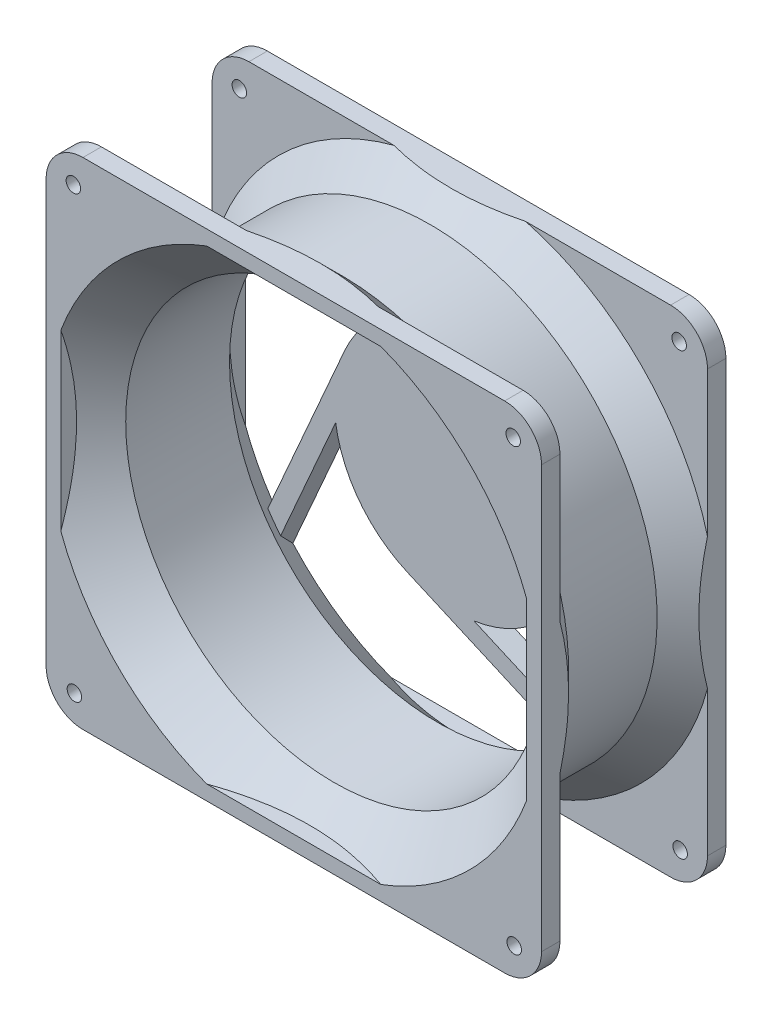
from build123d import *

# Parameters (mm, degrees)
CUT_EXTRUDE1_DEPTH      = 69.31434842
CUT_EXTRUDE1_DEPTH_BACK = 69.31434842
SKETCH3_OUTSIDE_W       = 124.306
SKETCH3_OUTSIDE_H       = 124.306
SKETCH3_OUTSIDE_W_2     = 67.161002078
SKETCH3_OUTSIDE_H_2     = 67.161002078
BOSS_EXTRUDE1_REACH     = 55.668
SKETCH4_W               = 35.612015526
SKETCH4_H               = 2
CIRPATTERN1_COUNT       = 4
MIRROR1_COPY_1_REACH    = 55.668
MIRROR1_COPY_1_SKETCH_W = 35.612015526
MIRROR1_COPY_1_SKETCH_H = 2
MIRROR1_COPY_2_REACH    = 55.668
MIRROR1_COPY_2_SKETCH_W = 35.612015526
MIRROR1_COPY_2_SKETCH_H = 2
MIRROR1_COPY_3_REACH    = 55.668
MIRROR1_COPY_3_SKETCH_W = 35.612015526
MIRROR1_COPY_3_SKETCH_H = 2
FILLET1_R               = 5
BOSS_EXTRUDE2_DEPTH     = 3
SKETCH8_R               = 9.506408827
CUT_EXTRUDE3_DEPTH      = 0.01
CUT_EXTRUDE4_DEPTH      = 0.01
SCALE1_SCALE            = 1.79
CUT_EXTRUDE5_REACH      = 98.066
SKETCH10_R              = 1.757559929


with BuildPart() as part:
    # Sketch2 → Revolve1 (revolve)
    with BuildSketch(Plane(origin=(0, 0, 0), x_dir=(0, 0, -1), z_dir=(1, 0, 0)), mode=Mode.PRIVATE) as revolve1_sk:
        Polygon((-6, 30.75), (6, 30.75), (10, 34.75), (10, 47.49), (12.5, 47.49), (12.5, 33.714466094), (7.035533906, 28.25), (-7.035533906, 28.25), (-12.5, 33.714466094), (-12.5, 47.49), (-10, 47.49), (-10, 34.75), align=None)
    revolve(revolve1_sk.sketch.rotate(Axis((0, 0, -4.682926829), (0, 0, 1)), 90), axis=Axis((0, 0, -4.682926829), (0, 0, 1)))

    # Sketch3 outside → Cut-Extrude1 (cut, two sides: drawn at the far end of the back side and taken through both)
    with BuildSketch(Plane.XY.offset(-CUT_EXTRUDE1_DEPTH_BACK)):
        Rectangle(SKETCH3_OUTSIDE_W, SKETCH3_OUTSIDE_H)
        Rectangle(SKETCH3_OUTSIDE_W_2, SKETCH3_OUTSIDE_H_2, mode=Mode.SUBTRACT)
    extrude(amount=CUT_EXTRUDE1_DEPTH + CUT_EXTRUDE1_DEPTH_BACK, mode=Mode.SUBTRACT)

    # Sketch4 → Boss-Extrude1 (add, up to next)
    with BuildSketch(Plane.XY.offset(12.5), mode=Mode.PRIVATE) as boss_extrude1_sk1:
        with Locations((-0.485506724, 32.580501039)):
            Rectangle(SKETCH4_W, SKETCH4_H)
    boss_extrude1_tool1 = extrude(boss_extrude1_sk1.sketch, amount=-BOSS_EXTRUDE1_REACH, mode=Mode.PRIVATE) - part.part
    boss_extrude1 = boss_extrude1_tool1.solids().sort_by_distance((-0.485507, 32.580501, 12.5))[0]
    add(boss_extrude1)

    # CirPattern1: Boss-Extrude1 ×4 about axis
    cirpattern1_axis = Axis((0, 0, 0), (0, 0, 1))
    for i in range(1, CIRPATTERN1_COUNT):
        add(boss_extrude1.rotate(cirpattern1_axis, i * 360 / CIRPATTERN1_COUNT))

    # Mirror1: Boss-Extrude1 across plane
    add(boss_extrude1.mirror(Plane.XY))

    # Mirror1 copy 1 sketch → Mirror1 copy 1 (add, up to next)
    with BuildSketch(Plane.YX.offset(12.5), mode=Mode.PRIVATE) as mirror1_copy_1_sk1:
        with Locations((-0.485506724, -32.580501039)):
            Rectangle(MIRROR1_COPY_1_SKETCH_W, MIRROR1_COPY_1_SKETCH_H)
    mirror1_copy_1_tool1 = extrude(mirror1_copy_1_sk1.sketch, amount=-MIRROR1_COPY_1_REACH, mode=Mode.PRIVATE) - part.part
    add(mirror1_copy_1_tool1.solids().sort_by_distance((-32.580501, -0.485507, -12.5))[0])

    # Mirror1 copy 2 sketch → Mirror1 copy 2 (add, up to next)
    with BuildSketch(Plane(origin=(0, 0, -12.5), x_dir=(-1, 0, 0), z_dir=(0, 0, -1)), mode=Mode.PRIVATE) as mirror1_copy_2_sk1:
        with Locations((-0.485506724, -32.580501039)):
            Rectangle(MIRROR1_COPY_2_SKETCH_W, MIRROR1_COPY_2_SKETCH_H)
    mirror1_copy_2_tool1 = extrude(mirror1_copy_2_sk1.sketch, amount=-MIRROR1_COPY_2_REACH, mode=Mode.PRIVATE) - part.part
    add(mirror1_copy_2_tool1.solids().sort_by_distance((0.485507, -32.580501, -12.5))[0])

    # Mirror1 copy 3 sketch → Mirror1 copy 3 (add, up to next)
    with BuildSketch(Plane(origin=(0, 0, -12.5), x_dir=(0, -1, 0), z_dir=(0, 0, -1)), mode=Mode.PRIVATE) as mirror1_copy_3_sk1:
        with Locations((-0.485506724, -32.580501039)):
            Rectangle(MIRROR1_COPY_3_SKETCH_W, MIRROR1_COPY_3_SKETCH_H)
    mirror1_copy_3_tool1 = extrude(mirror1_copy_3_sk1.sketch, amount=-MIRROR1_COPY_3_REACH, mode=Mode.PRIVATE) - part.part
    add(mirror1_copy_3_tool1.solids().sort_by_distance((32.580501, 0.485507, -12.5))[0])

    # Fillet1
    fillet1_edges = [part.edges().sort_by_distance(p)[0] for p in [
        (-33.580501039, 33.580501039, -11.25),
        (33.580501039, 33.580501039, -11.25),
        (33.580501039, -33.580501039, -11.25),
        (-33.580501039, -33.580501039, -11.25),
        (-33.580501039, 33.580501039, 11.25),
        (33.580501039, 33.580501039, 11.25),
        (33.580501039, -33.580501039, 11.25),
        (-33.580501039, -33.580501039, 11.25),
    ]]
    fillet(fillet1_edges, radius=FILLET1_R)

    # Sketch5 → Boss-Extrude2 (add)
    with BuildSketch(Plane(origin=(0, 0, -12.5), x_dir=(-1, 0, 0), z_dir=(0, 0, -1))):
        with BuildLine():
            Line((26.925347553, -20.290167154), (15.108670537, 6.631596687))
            ThreePointArc((15.108670537, 6.631596687), (10.016146833, 13.112086127), (2.424441224, 16.320909434))
            Line((2.424441224, 16.320909434), (22.48161384, 25.124535083))
            ThreePointArc((22.48161384, 25.124535083), (21.404836924, 26.047997625), (20.290167154, 26.925347553))
            Line((20.290167154, 26.925347553), (-6.631596687, 15.108670537))
            ThreePointArc((-6.631596687, 15.108670537), (-13.112086127, 10.016146833), (-16.320909434, 2.424441224))
            Line((-16.320909434, 2.424441224), (-25.124535083, 22.48161384))
            ThreePointArc((-25.124535083, 22.48161384), (-26.047997625, 21.404836924), (-26.925347553, 20.290167154))
            Line((-26.925347553, 20.290167154), (-15.108670537, -6.631596687))
            ThreePointArc((-15.108670537, -6.631596687), (-10.016146833, -13.112086127), (-2.424441224, -16.320909434))
            Line((-2.424441224, -16.320909434), (-22.48161384, -25.124535083))
            ThreePointArc((-22.48161384, -25.124535083), (-21.404836924, -26.047997625), (-20.290167154, -26.925347553))
            Line((-20.290167154, -26.925347553), (6.631596687, -15.108670537))
            ThreePointArc((6.631596687, -15.108670537), (13.112086127, -10.016146833), (16.320909434, -2.424441224))
            Line((16.320909434, -2.424441224), (25.124535083, -22.48161384))
            ThreePointArc((25.124535083, -22.48161384), (26.047997625, -21.404836924), (26.925347553, -20.290167154))
        make_face()
    extrude(amount=-BOSS_EXTRUDE2_DEPTH)

    # Sketch8 → Cut-Extrude3 (cut)
    with BuildSketch(Plane(origin=(0, 0, -12.5), x_dir=(-1, 0, 0), z_dir=(0, 0, -1))):
        Circle(SKETCH8_R)
    extrude(amount=-CUT_EXTRUDE3_DEPTH, mode=Mode.SUBTRACT)

    # Sketch9 → Cut-Extrude4 (cut)
    with BuildSketch(Plane(origin=(0, 0, -12.49), x_dir=(-1, 0, 0), z_dir=(0, 0, -1))):
        with BuildLine():
            Line((0.675180288, 4.913461538), (0.852564103, 4.617588141))
            add(Edge.make_bspline(
                [(0.852564103, 4.617588141), (0.806499718, 4.590069904), (0.718242134, 4.537346023), (0.598984093, 4.449394664), (0.497621937, 4.358261753), (0.414745329, 4.263272419), (0.349496442, 4.165006471), (0.303294211, 4.062822417), (0.274478235, 3.957064607), (0.270978149, 3.885090785), (0.269230769, 3.849158654)],
                knots=[0, 0, 0, 0, 1.272034388, 2.437168799, 3.508375237, 4.49857839, 5.41946034, 6.295179144, 7.148887113, 8, 8, 8, 8], degree=3))
            add(Edge.make_bspline(
                [(0.269230769, 3.849158654), (0.270085441, 3.81847179), (0.271779829, 3.757635011), (0.288060647, 3.668072814), (0.313072716, 3.581090837), (0.348893869, 3.498482855), (0.392231555, 3.421384873), (0.444580544, 3.353786497), (0.503176771, 3.295310861), (0.568595717, 3.247609116), (0.63870863, 3.210577942), (0.711319991, 3.18378116), (0.786110405, 3.16672662), (0.836816049, 3.164555919), (0.862379808, 3.163461538)],
                knots=[0, 0, 0, 0, 1.095270387, 2.171376115, 3.241375676, 4.322296363, 5.380636668, 6.392615365, 7.366724986, 8.328592944, 9.273498763, 10.190095884, 11.087518669, 12, 12, 12, 12], degree=3))
            add(Edge.make_bspline(
                [(0.862379808, 3.163461538), (0.891520657, 3.164935849), (0.950759747, 3.167932907), (1.0381594, 3.193264387), (1.12465197, 3.233113634), (1.178153235, 3.269876278), (1.205929487, 3.28896234)],
                knots=[0, 0, 0, 0, 0.938893495, 1.908633276, 2.914225137, 4, 4, 4, 4], degree=3))
            add(Edge.make_bspline(
                [(1.205929487, 3.28896234), (1.226017291, 3.304588591), (1.268312913, 3.337490246), (1.330218384, 3.394836934), (1.395634226, 3.460378655), (1.464294802, 3.534443072), (1.534946198, 3.618502429), (1.609061151, 3.710830671), (1.686416915, 3.811905743), (1.737571527, 3.883138886), (1.764022436, 3.919971955)],
                knots=[0, 0, 0, 0, 0.72226686, 1.520759855, 2.393439377, 3.351307446, 4.386958158, 5.510256019, 6.712608938, 8, 8, 8, 8], degree=3))
            add(Edge.make_bspline(
                [(1.764022436, 3.919971955), (1.790257027, 3.956791039), (1.840415567, 4.027186325), (1.914762239, 4.125708409), (1.983169392, 4.213690719), (2.044684139, 4.291581568), (2.101989442, 4.357365822), (2.152014057, 4.413448369), (2.197429242, 4.457760112), (2.226867212, 4.482418552), (2.240084135, 4.493489583)],
                knots=[0, 0, 0, 0, 1.452255772, 2.776602448, 3.96446981, 5.032613149, 5.964194703, 6.766668629, 7.446264616, 8, 8, 8, 8], degree=3))
            add(Edge.make_bspline(
                [(2.240084135, 4.493489583), (2.260685171, 4.508962129), (2.301199875, 4.539390965), (2.364524733, 4.579556971), (2.429347998, 4.613696134), (2.495843863, 4.640458466), (2.563078792, 4.662994685), (2.631930038, 4.678152615), (2.702088656, 4.687644012), (2.749302157, 4.688615999), (2.772936699, 4.689102564)],
                knots=[0, 0, 0, 0, 1.068054152, 2.10047183, 3.106115577, 4.101338837, 5.06977816, 6.043150881, 7.020423561, 8, 8, 8, 8], degree=3))
            add(Edge.make_bspline(
                [(2.772936699, 4.689102564), (2.809969574, 4.687803049), (2.883243772, 4.685231794), (2.990229619, 4.663308672), (3.092684247, 4.629110052), (3.188350891, 4.579648834), (3.277005834, 4.518496454), (3.357294574, 4.446223947), (3.425365503, 4.360416253), (3.484150669, 4.26574367), (3.530564015, 4.162785973), (3.565761611, 4.05509199), (3.585439222, 3.942189479), (3.588294703, 3.865589842), (3.58974359, 3.826722756)],
                knots=[0, 0, 0, 0, 1.005541892, 1.989591032, 2.955705311, 3.932863626, 4.905387107, 5.876519979, 6.856563935, 7.871847665, 8.897921447, 9.918317993, 10.943742853, 12, 12, 12, 12], degree=3))
            add(Edge.make_bspline(
                [(3.58974359, 3.826722756), (3.588347686, 3.785472508), (3.585579443, 3.703668333), (3.560648427, 3.583112286), (3.520376942, 3.466818515), (3.47399396, 3.373207727), (3.427876069, 3.300070601), (3.385853249, 3.244298835), (3.33747903, 3.187781097), (3.282619521, 3.130063127), (3.220772848, 3.072122443), (3.152362136, 3.013098998), (3.077805587, 2.952854727), (3.024581085, 2.914098867), (2.997295673, 2.894230769)],
                knots=[0, 0, 0, 0, 1.286821612, 2.551921131, 3.825787379, 5.12137259, 5.803616487, 6.523126609, 7.299589446, 8.125436757, 9.008162487, 9.944516264, 10.946261234, 12, 12, 12, 12], degree=3))
            Line((2.997295673, 2.894230769), (2.782051282, 3.178185096))
            add(Edge.make_bspline(
                [(2.782051282, 3.178185096), (2.804139973, 3.195331028), (2.846677627, 3.228350085), (2.906248935, 3.278479575), (2.960665442, 3.325728214), (3.007930479, 3.372278643), (3.050632911, 3.415672179), (3.087191686, 3.457789534), (3.11797047, 3.49802287), (3.150800721, 3.548744018), (3.183551326, 3.61262958), (3.210674418, 3.692745333), (3.227560433, 3.776240418), (3.229687874, 3.832952608), (3.230769231, 3.861778846)],
                knots=[0, 0, 0, 0, 1.181667846, 2.275615987, 3.290305621, 4.226321945, 5.078535498, 5.862783384, 6.581873284, 7.217493746, 8.414623899, 9.604724551, 10.782505457, 12, 12, 12, 12], degree=3))
            add(Edge.make_bspline(
                [(3.230769231, 3.861778846), (3.229557531, 3.897935369), (3.227220882, 3.967659816), (3.201700896, 4.066650052), (3.161519036, 4.155743977), (3.105204058, 4.232296542), (3.038483065, 4.296033519), (2.96170421, 4.342138978), (2.876921808, 4.369889143), (2.817780151, 4.373275422), (2.787660256, 4.375)],
                knots=[0, 0, 0, 0, 1.14458467, 2.207223713, 3.21896685, 4.227309161, 5.202851033, 6.127160689, 7.046193047, 8, 8, 8, 8], degree=3))
            add(Edge.make_bspline(
                [(2.787660256, 4.375), (2.768913559, 4.374588572), (2.731389509, 4.373765043), (2.675804871, 4.36305417), (2.620713639, 4.347866473), (2.565870844, 4.325638344), (2.509986268, 4.295698052), (2.453210792, 4.254988255), (2.394110972, 4.204058624), (2.355710822, 4.164969048), (2.335436699, 4.144330929)],
                knots=[0, 0, 0, 0, 0.858526328, 1.718456515, 2.587092892, 3.476767204, 4.426280253, 5.487868114, 6.673670035, 8, 8, 8, 8], degree=3))
            add(Edge.make_bspline(
                [(2.335436699, 4.144330929), (2.328599673, 4.136669557), (2.312356465, 4.11846789), (2.285764184, 4.085191964), (2.252961412, 4.041249166), (2.212374095, 3.987786965), (2.165292633, 3.923819603), (2.112319021, 3.849340047), (2.051733562, 3.765178514), (2.009376021, 3.705456598), (1.986979167, 3.673878205)],
                knots=[0, 0, 0, 0, 0.420754252, 0.999615792, 1.744751191, 2.668019286, 3.750313428, 4.999500688, 6.413464383, 8, 8, 8, 8], degree=3))
            add(Edge.make_bspline(
                [(1.986979167, 3.673878205), (1.959337807, 3.635892292), (1.905814145, 3.562337835), (1.825398465, 3.457680256), (1.746750697, 3.362786447), (1.67037309, 3.277323244), (1.596844997, 3.200446335), (1.525281816, 3.133008615), (1.456196244, 3.074322934), (1.367623668, 3.011143716), (1.258842584, 2.946585896), (1.125564345, 2.891144389), (0.991768025, 2.856186042), (0.901841188, 2.851614526), (0.857471955, 2.849358974)],
                knots=[0, 0, 0, 0, 1.163667725, 2.253281268, 3.268753668, 4.215851969, 5.092017293, 5.902905408, 6.650798638, 7.335211899, 8.59617414, 9.77448103, 10.901945474, 12, 12, 12, 12], degree=3))
            add(Edge.make_bspline(
                [(0.857471955, 2.849358974), (0.826093837, 2.850016478), (0.763946944, 2.851318716), (0.67268827, 2.866274321), (0.584070778, 2.888213729), (0.499109563, 2.921177025), (0.416667774, 2.961724993), (0.337504814, 3.011807554), (0.262708929, 3.072182048), (0.190723622, 3.139285854), (0.125700195, 3.213860485), (0.067544021, 3.292492297), (0.01886767, 3.375691775), (-0.020316919, 3.463056226), (-0.051449277, 3.554102367), (-0.073826566, 3.648926014), (-0.08759193, 3.747791221), (-0.089018363, 3.814992295), (-0.08974359, 3.849158654)],
                knots=[0, 0, 0, 0, 0.983610584, 1.948120116, 2.894308362, 3.843560551, 4.801159957, 5.773581695, 6.77566113, 7.813174769, 8.857584665, 9.875476876, 10.877851407, 11.875574773, 12.875048225, 13.892438445, 14.928473903, 16, 16, 16, 16], degree=3))
            add(Edge.make_bspline(
                [(-0.08974359, 3.849158654), (-0.089226551, 3.87559283), (-0.088198985, 3.928128272), (-0.079329853, 4.005625969), (-0.066323164, 4.081700573), (-0.046492674, 4.155396877), (-0.021866355, 4.227632532), (0.00828501, 4.297763652), (0.044178677, 4.365960624), (0.085874098, 4.432303084), (0.133926601, 4.497416168), (0.189458269, 4.56096606), (0.252085534, 4.623679776), (0.322450651, 4.684407677), (0.399801843, 4.744269137), (0.484787237, 4.802150925), (0.576965667, 4.859231683), (0.6418306, 4.895047287), (0.675180288, 4.913461538)],
                knots=[0, 0, 0, 0, 0.915384692, 1.819241058, 2.699029451, 3.586605375, 4.459625921, 5.340865773, 6.228072412, 7.126546901, 8.052715223, 9.028303326, 10.047266019, 11.120332924, 12.245748783, 13.433636234, 14.680528497, 16, 16, 16, 16], degree=3))
        make_face()
        Polygon((2.557692308, 1.144230769), (2.557692308, 0.805588942), (0.598758013, -0.060296474), (2.557692308, -0.939503205), (2.557692308, -1.278846154), (-0.942307692, 0.291666667), (-0.942307692, 0.631009615), (0.218048878, 0.110076122), align=None)
        with BuildLine():
            Line((3.5, -4.28525641), (3.5, -4.599358974))
            Line((3.5, -4.599358974), (1.136518429, -4.599358974))
            add(Edge.make_bspline(
                [(1.136518429, -4.599358974), (1.092812917, -4.599047697), (1.008893, -4.598450007), (0.888023601, -4.595100811), (0.777637927, -4.589083271), (0.67759751, -4.579777611), (0.587920109, -4.5690564), (0.50830743, -4.555148032), (0.439154854, -4.538702564), (0.361542044, -4.513790464), (0.276140858, -4.473168766), (0.1846454, -4.410885966), (0.103958256, -4.334795343), (0.034149099, -4.246430162), (-0.021520188, -4.145306888), (-0.061472003, -4.033403716), (-0.085843802, -3.911438518), (-0.088417574, -3.826839109), (-0.08974359, -3.783253205)],
                knots=[0, 0, 0, 0, 1.237549021, 2.376245131, 3.423509879, 4.367128923, 5.220764738, 5.980167839, 6.654279555, 7.23186528, 8.285695362, 9.319068926, 10.353713031, 11.414109097, 12.495220016, 13.606748513, 14.766988686, 16, 16, 16, 16], degree=3))
            add(Edge.make_bspline(
                [(-0.08974359, -3.783253205), (-0.088697799, -3.749055471), (-0.086607883, -3.68071443), (-0.068540702, -3.578865317), (-0.04175024, -3.477542371), (-0.001239928, -3.376070295), (0.052924018, -3.272302912), (0.124152448, -3.164744448), (0.211970539, -3.052116365), (0.279010274, -2.977933803), (0.314102564, -2.939102564)],
                knots=[0, 0, 0, 0, 0.854372818, 1.707385869, 2.579105618, 3.471016644, 4.432770875, 5.500780854, 6.691771033, 8, 8, 8, 8], degree=3))
            Line((0.314102564, -2.939102564), (0.583333333, -3.124198718))
            add(Edge.make_bspline(
                [(0.583333333, -3.124198718), (0.553940671, -3.166934339), (0.498556334, -3.247460698), (0.426333146, -3.36555087), (0.365625675, -3.470906823), (0.334215346, -3.539733508), (0.319711538, -3.571514423)],
                knots=[0, 0, 0, 0, 1.196704426, 2.25493972, 3.19421351, 4, 4, 4, 4], degree=3))
            add(Edge.make_bspline(
                [(0.319711538, -3.571514423), (0.312152081, -3.590798735), (0.297326302, -3.628619564), (0.280780404, -3.686444644), (0.271737994, -3.743939681), (0.270056661, -3.782057374), (0.269230769, -3.80078125)],
                knots=[0, 0, 0, 0, 1.051806502, 2.062826769, 3.048436908, 4, 4, 4, 4], degree=3))
            add(Edge.make_bspline(
                [(0.269230769, -3.80078125), (0.270221373, -3.824972996), (0.272170121, -3.872563779), (0.290411058, -3.941896433), (0.317154531, -4.008540904), (0.357284706, -4.069750541), (0.404691168, -4.126027342), (0.462024835, -4.172545731), (0.525781783, -4.211008571), (0.585651457, -4.235316157), (0.640678911, -4.249975791), (0.691030459, -4.259685634), (0.750129188, -4.266712725), (0.817602959, -4.274283847), (0.893914761, -4.2783622), (0.978713384, -4.283118983), (1.072242971, -4.284812253), (1.137453677, -4.28510384), (1.171574519, -4.28525641)],
                knots=[0, 0, 0, 0, 0.99710849, 1.961544003, 2.943780681, 3.950512064, 4.9701611, 5.971139155, 6.984143068, 8.036211364, 8.626223178, 9.334153146, 10.151809154, 11.083375733, 12.13756692, 13.306844995, 14.590833851, 16, 16, 16, 16], degree=3))
            Line((1.171574519, -4.28525641), (3.5, -4.28525641))
        make_face()
    extrude(amount=-CUT_EXTRUDE4_DEPTH, mode=Mode.SUBTRACT)


with BuildPart() as part_1:
    # Scale1: scaled about (0, 0, 0)
    add(part.part.scale(SCALE1_SCALE))

    # Sketch10 → Cut-Extrude5 (cut, up to next)
    with BuildSketch(Plane(origin=(0, 0, -22.375), x_dir=(-1, 0, 0), z_dir=(0, 0, -1)), mode=Mode.PRIVATE) as cut_extrude5_sk1:
        with Locations((53.486626347, 53.238620352)):
            Circle(SKETCH10_R)
    cut_extrude5_tool1 = extrude(cut_extrude5_sk1.sketch, amount=-CUT_EXTRUDE5_REACH, mode=Mode.PRIVATE) & part_1.part
    # Sketch10 → Cut-Extrude5 (cut, up to next)
    with BuildSketch(Plane(origin=(0, 0, -22.375), x_dir=(-1, 0, 0), z_dir=(0, 0, -1)), mode=Mode.PRIVATE) as cut_extrude5_sk2:
        with Locations((53.238620352, -53.486626347)):
            Circle(SKETCH10_R)
    cut_extrude5_tool2 = extrude(cut_extrude5_sk2.sketch, amount=-CUT_EXTRUDE5_REACH, mode=Mode.PRIVATE) & part_1.part
    # Sketch10 → Cut-Extrude5 (cut, up to next)
    with BuildSketch(Plane(origin=(0, 0, -22.375), x_dir=(-1, 0, 0), z_dir=(0, 0, -1)), mode=Mode.PRIVATE) as cut_extrude5_sk3:
        with Locations((-53.486626347, -53.238620352)):
            Circle(SKETCH10_R)
    cut_extrude5_tool3 = extrude(cut_extrude5_sk3.sketch, amount=-CUT_EXTRUDE5_REACH, mode=Mode.PRIVATE) & part_1.part
    # Sketch10 → Cut-Extrude5 (cut, up to next)
    with BuildSketch(Plane(origin=(0, 0, -22.375), x_dir=(-1, 0, 0), z_dir=(0, 0, -1)), mode=Mode.PRIVATE) as cut_extrude5_sk4:
        with Locations((-53.238620352, 53.486626347)):
            Circle(SKETCH10_R)
    cut_extrude5_tool4 = extrude(cut_extrude5_sk4.sketch, amount=-CUT_EXTRUDE5_REACH, mode=Mode.PRIVATE) & part_1.part
    add(cut_extrude5_tool1.solids().sort_by_distance((-53.486626, 53.23862, -22.375))[0], mode=Mode.SUBTRACT)
    add(cut_extrude5_tool1.solids().sort_by_distance((-53.486626, 53.23862, -22.375))[1], mode=Mode.SUBTRACT)
    add(cut_extrude5_tool2.solids().sort_by_distance((-53.23862, -53.486626, -22.375))[0], mode=Mode.SUBTRACT)
    add(cut_extrude5_tool2.solids().sort_by_distance((-53.23862, -53.486626, -22.375))[1], mode=Mode.SUBTRACT)
    add(cut_extrude5_tool3.solids().sort_by_distance((53.486626, -53.23862, -22.375))[0], mode=Mode.SUBTRACT)
    add(cut_extrude5_tool3.solids().sort_by_distance((53.486626, -53.23862, -22.375))[1], mode=Mode.SUBTRACT)
    add(cut_extrude5_tool4.solids().sort_by_distance((53.23862, 53.486626, -22.375))[0], mode=Mode.SUBTRACT)
    add(cut_extrude5_tool4.solids().sort_by_distance((53.23862, 53.486626, -22.375))[1], mode=Mode.SUBTRACT)


solid = part_1.part
